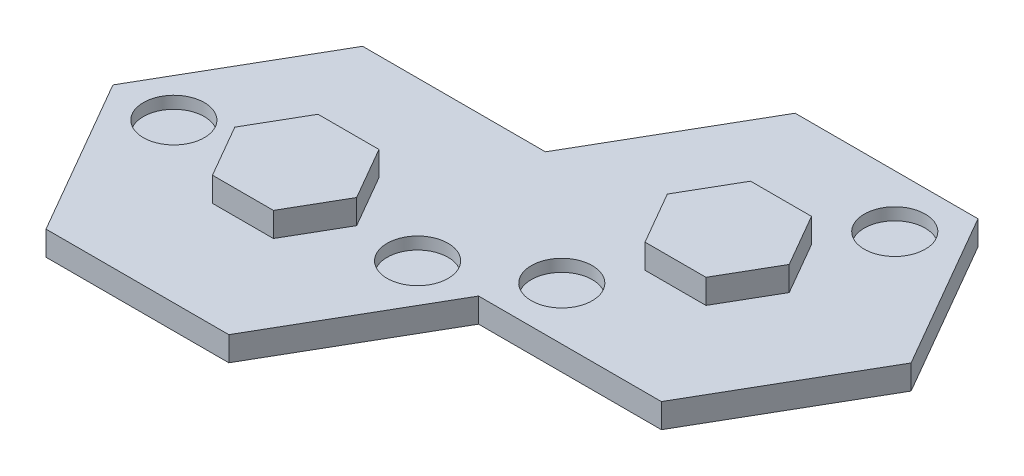
from build123d import *

# Parameters (mm, degrees)
BOSS_EXTRUDE1_DEPTH = 10.16
SKETCH2_R           = 12.7
CUT_EXTRUDE1_DEPTH  = 5.08
BOSS_EXTRUDE2_DEPTH = 10.16


with BuildPart() as part:
    # Sketch1 → Boss-Extrude1 (new body)
    with BuildSketch(Plane(origin=(0, 0, 0), x_dir=(1, 0, 0), z_dir=(0, 1, 0))):
        Polygon((38.1, 65.991135768), (-38.1, 65.991135768), (-76.2, 0), (-38.1, -65.991135768), (38.1, -65.991135768), (76.2, 0), align=None)
    boss_extrude1 = extrude(amount=BOSS_EXTRUDE1_DEPTH)

    # Sketch2 → Cut-Extrude1 (cut)
    with BuildSketch(Plane(origin=(0, 10.16, 0), x_dir=(1, 0, 0), z_dir=(0, 1, 0))):
        with Locations(Location((-50.8, 0, 0), (0, 0, 270))):
            Circle(SKETCH2_R)
        with Locations(Location((50.8, 0, 0), (0, 0, 90))):
            Circle(SKETCH2_R)
    cut_extrude1 = extrude(amount=-CUT_EXTRUDE1_DEPTH, mode=Mode.SUBTRACT)

    # Mirror1: Boss-Extrude1, Cut-Extrude1 across plane
    add(boss_extrude1.mirror(Plane(origin=(76.2, 10.16, 0), x_dir=(0.4999999999999999, 0, 0.8660254037844386), z_dir=(-0.8660254037844388, 0, 0.4999999999999999))))
    add(cut_extrude1.mirror(Plane(origin=(76.2, 10.16, 0), x_dir=(0.4999999999999999, 0, 0.8660254037844386), z_dir=(-0.8660254037844388, 0, 0.4999999999999999))), mode=Mode.SUBTRACT)

    # Sketch3 → Boss-Extrude2 (add)
    with BuildSketch(Plane(origin=(0, 10.16, 0), x_dir=(1, 0, 0), z_dir=(0, 1, 0))):
        Polygon((12.7, 21.997045256), (-12.7, 21.997045256), (-25.4, 0), (-12.7, -21.997045256), (12.7, -21.997045256), (25.4, 0), align=None)
    boss_extrude2 = extrude(amount=BOSS_EXTRUDE2_DEPTH)

    # Mirror2: Boss-Extrude2 across plane
    add(boss_extrude2.mirror(Plane(origin=(57.15, 0, -32.995567884), x_dir=(0.5000000000000001, 1.528537227064212e-15, 0.8660254037844386), z_dir=(0.8660254037844386, 2.64750413853566e-15, -0.5000000000000001))))


solid = part.part
